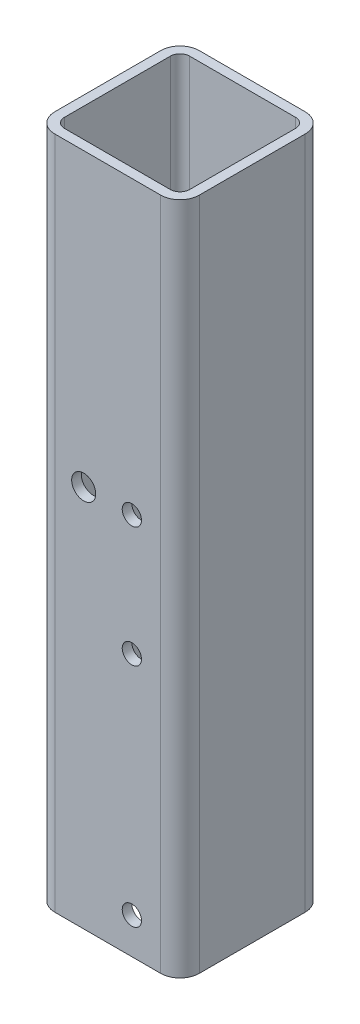
from build123d import *

# Parameters (mm, degrees)
EXTRUDE_1_DEPTH     = 70
SKETCH_3_R          = 2.5
SKETCH_3_R_2        = 2
CUT_EXTRUDE_1_DEPTH = 82.853527719


with BuildPart() as part:
    # 草图2 → 凸台-拉伸1 (new, symmetric)
    with BuildSketch(Plane(origin=(0, 0, 0), x_dir=(1, 0, 0), z_dir=(0, 1, 0))):
        with BuildLine():
            Line((4, 0), (26, 0))
            ThreePointArc((26, 0), (28.828427125, 1.171572875), (30, 4))
            Line((30, 4), (30, 26))
            ThreePointArc((30, 26), (28.828427125, 28.828427125), (26, 30))
            Line((26, 30), (4, 30))
            ThreePointArc((4, 30), (1.171572875, 28.828427125), (0, 26))
            Line((0, 26), (0, 4))
            ThreePointArc((0, 4), (1.171572875, 1.171572875), (4, 0))
        make_face()
        with BuildLine():
            Line((4, 2), (26, 2))
            ThreePointArc((26, 2), (27.414213562, 2.585786438), (28, 4))
            Line((28, 4), (28, 26))
            ThreePointArc((28, 26), (27.414213562, 27.414213562), (26, 28))
            Line((26, 28), (4, 28))
            ThreePointArc((4, 28), (2.585786438, 27.414213562), (2, 26))
            Line((2, 26), (2, 4))
            ThreePointArc((2, 4), (2.585786438, 2.585786438), (4, 2))
        make_face(mode=Mode.SUBTRACT)
    extrude(amount=EXTRUDE_1_DEPTH, both=True)

    # 草图3 → 切除-拉伸1 (cut, through all)
    with BuildSketch(Plane.XY):
        with Locations((10, 9.5)):
            Circle(SKETCH_3_R)
        with Locations((20, 9.5)):
            Circle(SKETCH_3_R_2)
        with Locations((20, -15.5)):
            Circle(SKETCH_3_R_2)
        with Locations((20, -62.5)):
            Circle(SKETCH_3_R_2)
    extrude(amount=-CUT_EXTRUDE_1_DEPTH, mode=Mode.SUBTRACT)


solid = part.part
